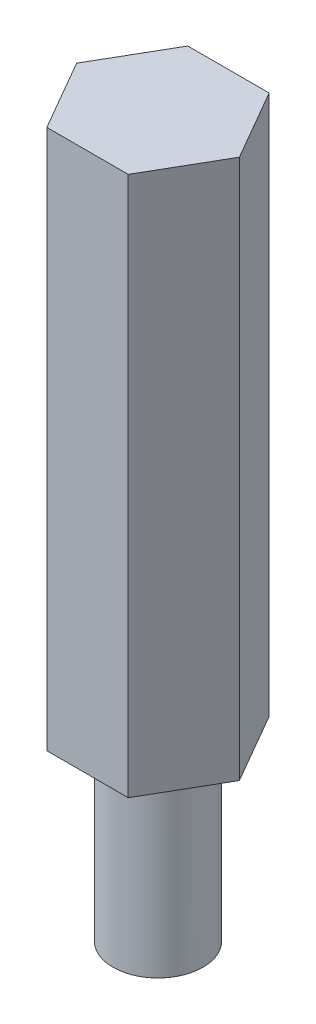
from build123d import *

# Parameters (mm, degrees)
EXTRUDE_1_DEPTH = 18
SKETCH_2_R      = 1.5
EXTRUDE_2_DEPTH = 6


with BuildPart() as part:
    # 草图1 → 凸台-拉伸1 (new body)
    with BuildSketch(Plane(origin=(0, 0, 0), x_dir=(1, 0, 0), z_dir=(0, 1, 0))):
        Polygon((-1.356773133, 2.35), (-2.713546265, 0), (-1.356773133, -2.35), (1.356773133, -2.35), (2.713546265, 0), (1.356773133, 2.35), align=None)
    extrude(amount=EXTRUDE_1_DEPTH)

    # 草图2 → 凸台-拉伸2 (add)
    with BuildSketch(Plane.XZ):
        with Locations(Location((0, 0, 0), (0, 0, 90))):
            Circle(SKETCH_2_R)
    extrude(amount=EXTRUDE_2_DEPTH)


solid = part.part
